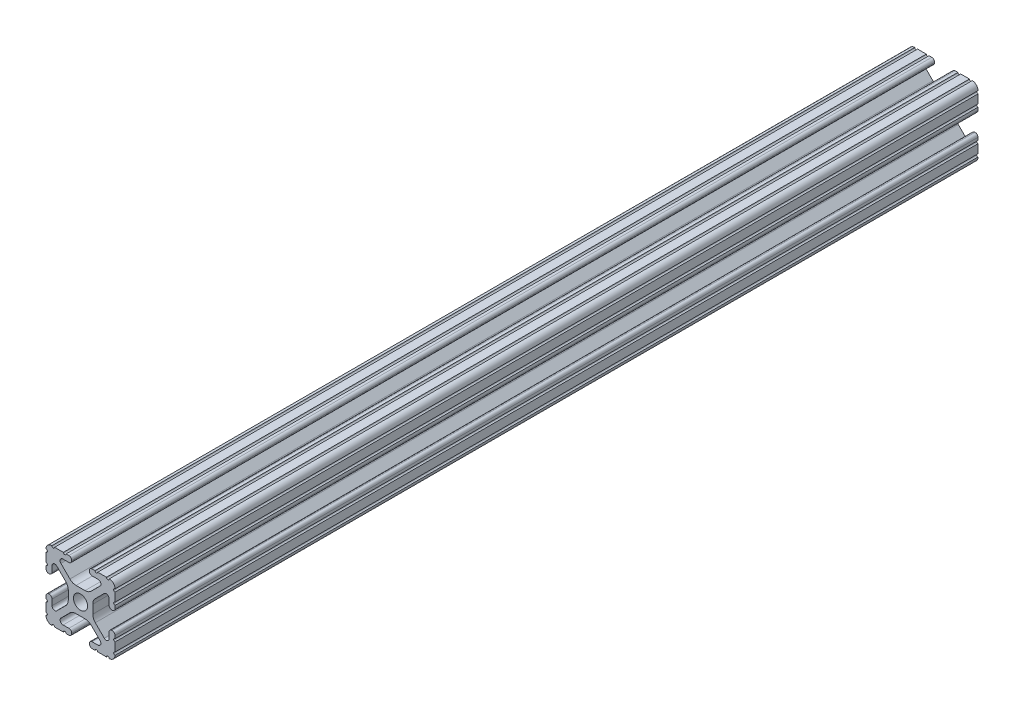
from build123d import *

# Parameters (mm, degrees)
SKETCH1_R      = 2.6035
EXTRUDE1_DEPTH = 317.5


with BuildPart() as part:
    # Sketch1 → Extrude1 (new body)
    with BuildSketch(Plane.XY):
        with BuildLine():
            Line((-7.207036008, 8.724370562), (-3.898272566, 5.423169045))
            ThreePointArc((-3.898272566, 5.423169045), (-2.869120213, 4.736787962), (-1.655778399, 4.4958))
            Line((-1.655778399, 4.4958), (1.655778399, 4.4958))
            ThreePointArc((1.655778399, 4.4958), (2.869120213, 4.736787962), (3.898272566, 5.423169045))
            Line((3.898272566, 5.423169045), (7.207036008, 8.724370562))
            ThreePointArc((7.207036008, 8.724370562), (7.432222385, 9.85140422), (6.476788598, 10.4902))
            Line((6.476788598, 10.4902), (4.287512407, 10.4902))
            ThreePointArc((4.287512407, 10.4902), (3.54574862, 10.79744862), (3.2385, 11.539212407))
            Line((3.2385, 11.539212407), (3.2385, 11.650987593))
            ThreePointArc((3.2385, 11.650987593), (3.54574862, 12.39275138), (4.287512407, 12.7))
            Line((4.287512407, 12.7), (5.317126718, 12.7))
            ThreePointArc((5.317126718, 12.7), (5.825126718, 12.192), (6.333126718, 12.7))
            Line((6.333126718, 12.7), (9.550443118, 12.7))
            ThreePointArc((9.550443118, 12.7), (10.058366869, 12.192000006), (10.566443095, 12.699847501))
            ThreePointArc((10.566443095, 12.699847501), (12.082537762, 12.08250727), (12.699846982, 10.566399977))
            ThreePointArc((12.699846982, 10.566399977), (12.192000006, 10.058323491), (12.7, 9.5504))
            Line((12.7, 9.5504), (12.7, 6.3330836))
            ThreePointArc((12.7, 6.3330836), (12.192, 5.8250836), (12.7, 5.3170836))
            Line((12.7, 5.3170836), (12.7, 4.287469289))
            ThreePointArc((12.7, 4.287469289), (12.39275138, 3.545705502), (11.650987593, 3.238456882))
            Line((11.650987593, 3.238456882), (11.539212407, 3.238456882))
            ThreePointArc((11.539212407, 3.238456882), (10.79744862, 3.545705502), (10.4902, 4.287469289))
            Line((10.4902, 4.287469289), (10.4902, 6.402089023))
            ThreePointArc((10.4902, 6.402089023), (9.856505071, 7.351067942), (8.737131347, 7.129408934))
            Line((8.737131347, 7.129408934), (5.441005833, 3.840816462))
            ThreePointArc((5.441005833, 3.840816462), (4.750877967, 2.809883091), (4.5085, 1.593185507))
            Line((4.5085, 1.593185507), (4.5085, -1.593185507))
            ThreePointArc((4.5085, -1.593185507), (4.750877967, -2.809883091), (5.441005833, -3.840816462))
            Line((5.441005833, -3.840816462), (8.737131347, -7.129408934))
            ThreePointArc((8.737131347, -7.129408934), (9.856505071, -7.351067942), (10.4902, -6.402089023))
            Line((10.4902, -6.402089023), (10.4902, -4.287469289))
            ThreePointArc((10.4902, -4.287469289), (10.79744862, -3.545705502), (11.539212407, -3.238456882))
            Line((11.539212407, -3.238456882), (11.650987593, -3.238456882))
            ThreePointArc((11.650987593, -3.238456882), (12.39275138, -3.545705502), (12.7, -4.287469289))
            Line((12.7, -4.287469289), (12.7, -5.3170836))
            ThreePointArc((12.7, -5.3170836), (12.192, -5.8250836), (12.7, -6.3330836))
            Line((12.7, -6.3330836), (12.7, -9.5504))
            ThreePointArc((12.7, -9.5504), (12.192000006, -10.058323491), (12.699846982, -10.566399977))
            ThreePointArc((12.699846982, -10.566399977), (12.082537762, -12.08250727), (10.566443095, -12.699847501))
            ThreePointArc((10.566443095, -12.699847501), (10.058366869, -12.192000006), (9.550443118, -12.7))
            Line((9.550443118, -12.7), (6.333126718, -12.7))
            ThreePointArc((6.333126718, -12.7), (5.825126718, -12.192), (5.317126718, -12.7))
            Line((5.317126718, -12.7), (4.287512407, -12.7))
            ThreePointArc((4.287512407, -12.7), (3.54574862, -12.39275138), (3.2385, -11.650987593))
            Line((3.2385, -11.650987593), (3.2385, -11.539212407))
            ThreePointArc((3.2385, -11.539212407), (3.54574862, -10.79744862), (4.287512407, -10.4902))
            Line((4.287512407, -10.4902), (6.416408329, -10.4902))
            ThreePointArc((6.416408329, -10.4902), (7.41473083, -9.822813117), (7.179650497, -8.645192506))
            Line((7.179650497, -8.645192506), (3.952270251, -5.423690499))
            ThreePointArc((3.952270251, -5.423690499), (2.922936451, -4.736929036), (1.709253557, -4.4958))
            Line((1.709253557, -4.4958), (-1.709253557, -4.4958))
            ThreePointArc((-1.709253557, -4.4958), (-2.922936451, -4.736929036), (-3.952270251, -5.423690499))
            Line((-3.952270251, -5.423690499), (-7.179650497, -8.645192506))
            ThreePointArc((-7.179650497, -8.645192506), (-7.41473083, -9.822813117), (-6.416408329, -10.4902))
            Line((-6.416408329, -10.4902), (-4.287512407, -10.4902))
            ThreePointArc((-4.287512407, -10.4902), (-3.54574862, -10.79744862), (-3.2385, -11.539212407))
            Line((-3.2385, -11.539212407), (-3.2385, -11.650987593))
            ThreePointArc((-3.2385, -11.650987593), (-3.54574862, -12.39275138), (-4.287512407, -12.7))
            Line((-4.287512407, -12.7), (-5.317126718, -12.7))
            ThreePointArc((-5.317126718, -12.7), (-5.825126718, -12.192), (-6.333126718, -12.7))
            Line((-6.333126718, -12.7), (-9.550443118, -12.7))
            ThreePointArc((-9.550443118, -12.7), (-10.058366869, -12.192000006), (-10.566443095, -12.699847501))
            ThreePointArc((-10.566443095, -12.699847501), (-12.082537762, -12.08250727), (-12.699846982, -10.566399977))
            ThreePointArc((-12.699846982, -10.566399977), (-12.192000006, -10.058323491), (-12.7, -9.5504))
            Line((-12.7, -9.5504), (-12.7, -6.3330836))
            ThreePointArc((-12.7, -6.3330836), (-12.192, -5.8250836), (-12.7, -5.3170836))
            Line((-12.7, -5.3170836), (-12.7, -4.287469289))
            ThreePointArc((-12.7, -4.287469289), (-12.39275138, -3.545705502), (-11.650987593, -3.238456882))
            Line((-11.650987593, -3.238456882), (-11.539212407, -3.238456882))
            ThreePointArc((-11.539212407, -3.238456882), (-10.79744862, -3.545705502), (-10.4902, -4.287469289))
            Line((-10.4902, -4.287469289), (-10.4902, -6.402089023))
            ThreePointArc((-10.4902, -6.402089023), (-9.856505071, -7.351067942), (-8.737131347, -7.129408934))
            Line((-8.737131347, -7.129408934), (-5.441005833, -3.840816462))
            ThreePointArc((-5.441005833, -3.840816462), (-4.750877967, -2.809883091), (-4.5085, -1.593185507))
            Line((-4.5085, -1.593185507), (-4.5085, 1.593185507))
            ThreePointArc((-4.5085, 1.593185507), (-4.750877967, 2.809883091), (-5.441005833, 3.840816462))
            Line((-5.441005833, 3.840816462), (-8.737131347, 7.129408934))
            ThreePointArc((-8.737131347, 7.129408934), (-9.856505071, 7.351067942), (-10.4902, 6.402089023))
            Line((-10.4902, 6.402089023), (-10.4902, 4.287469289))
            ThreePointArc((-10.4902, 4.287469289), (-10.79744862, 3.545705502), (-11.539212407, 3.238456882))
            Line((-11.539212407, 3.238456882), (-11.650987593, 3.238456882))
            ThreePointArc((-11.650987593, 3.238456882), (-12.39275138, 3.545705502), (-12.7, 4.287469289))
            Line((-12.7, 4.287469289), (-12.7, 5.3170836))
            ThreePointArc((-12.7, 5.3170836), (-12.192, 5.8250836), (-12.7, 6.3330836))
            Line((-12.7, 6.3330836), (-12.7, 9.5504))
            ThreePointArc((-12.7, 9.5504), (-12.192000006, 10.058323491), (-12.699846982, 10.566399977))
            ThreePointArc((-12.699846982, 10.566399977), (-12.082537762, 12.08250727), (-10.566443095, 12.699847501))
            ThreePointArc((-10.566443095, 12.699847501), (-10.058366869, 12.192000006), (-9.550443118, 12.7))
            Line((-9.550443118, 12.7), (-6.333126718, 12.7))
            ThreePointArc((-6.333126718, 12.7), (-5.825126718, 12.192), (-5.317126718, 12.7))
            Line((-5.317126718, 12.7), (-4.287512407, 12.7))
            ThreePointArc((-4.287512407, 12.7), (-3.54574862, 12.39275138), (-3.2385, 11.650987593))
            Line((-3.2385, 11.650987593), (-3.2385, 11.539212407))
            ThreePointArc((-3.2385, 11.539212407), (-3.54574862, 10.79744862), (-4.287512407, 10.4902))
            Line((-4.287512407, 10.4902), (-6.476788598, 10.4902))
            ThreePointArc((-6.476788598, 10.4902), (-7.432222385, 9.85140422), (-7.207036008, 8.724370562))
        make_face()
        Circle(SKETCH1_R, mode=Mode.SUBTRACT)
    extrude(amount=-EXTRUDE1_DEPTH)


solid = part.part
